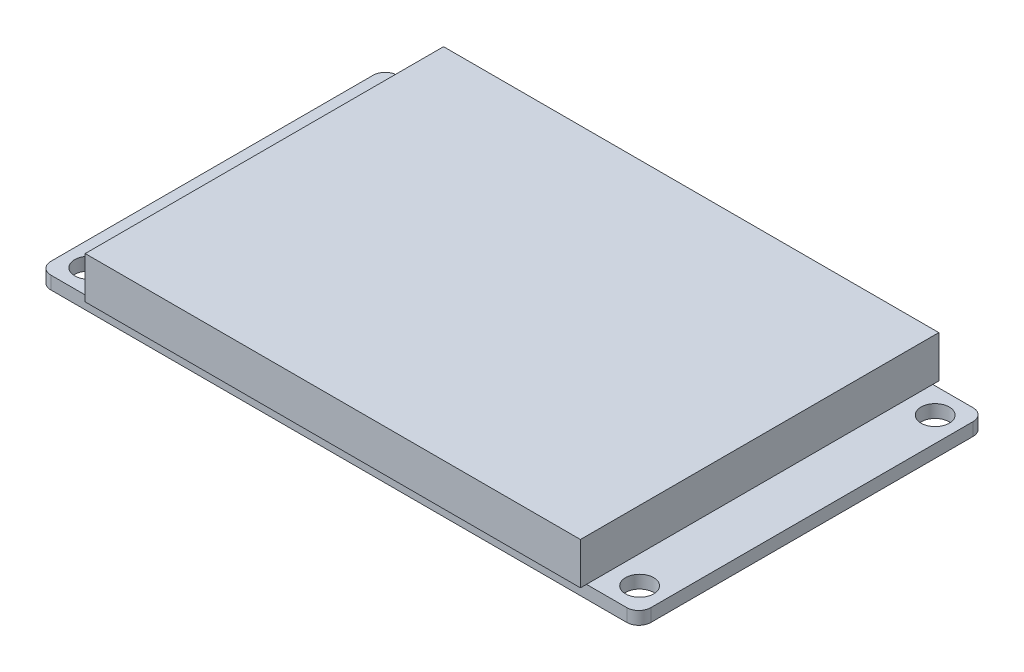
from build123d import *

# Parameters (mm, degrees)
SKETCH_1_R      = 1.75
EXTRUDE_1_DEPTH = 1.6
SKETCH_2_W      = 61.5
SKETCH_2_H      = 44.5
EXTRUDE_2_DEPTH = 5.2


with BuildPart() as part:
    # 草图1 → 凸台-拉伸1 (new body)
    with BuildSketch(Plane(origin=(0, 0, 0), x_dir=(1, 0, 0), z_dir=(0, 1, 0))):
        with BuildLine():
            Line((1.5, 0), (73, 0))
            ThreePointArc((73, 0), (74.060660172, 0.439339828), (74.5, 1.5))
            Line((74.5, 1.5), (74.5, 41.5))
            ThreePointArc((74.5, 41.5), (74.060660172, 42.560660172), (73, 43))
            Line((73, 43), (1.5, 43))
            ThreePointArc((1.5, 43), (0.439339828, 42.560660172), (0, 41.5))
            Line((0, 41.5), (0, 1.5))
            ThreePointArc((0, 1.5), (0.439339828, 0.439339828), (1.5, 0))
        make_face()
        with Locations(Location((3.05, 39.85, 0), (0, 0, 270))):
            Circle(SKETCH_1_R, mode=Mode.SUBTRACT)
        with Locations(Location((3.05, 3.15, 0), (0, 0, 270))):
            Circle(SKETCH_1_R, mode=Mode.SUBTRACT)
        with Locations(Location((71.45, 39.85, 0), (0, 0, 270))):
            Circle(SKETCH_1_R, mode=Mode.SUBTRACT)
        with Locations(Location((71.45, 3.15, 0), (0, 0, 270))):
            Circle(SKETCH_1_R, mode=Mode.SUBTRACT)
    extrude(amount=EXTRUDE_1_DEPTH)

    # 草图2 → 凸台-拉伸2 (add)
    with BuildSketch(Plane(origin=(0, 1.6, 0), x_dir=(1, 0, 0), z_dir=(0, 1, 0))):
        with Locations((37.25, 21.5)):
            Rectangle(SKETCH_2_W, SKETCH_2_H)
    extrude(amount=EXTRUDE_2_DEPTH)


solid = part.part
